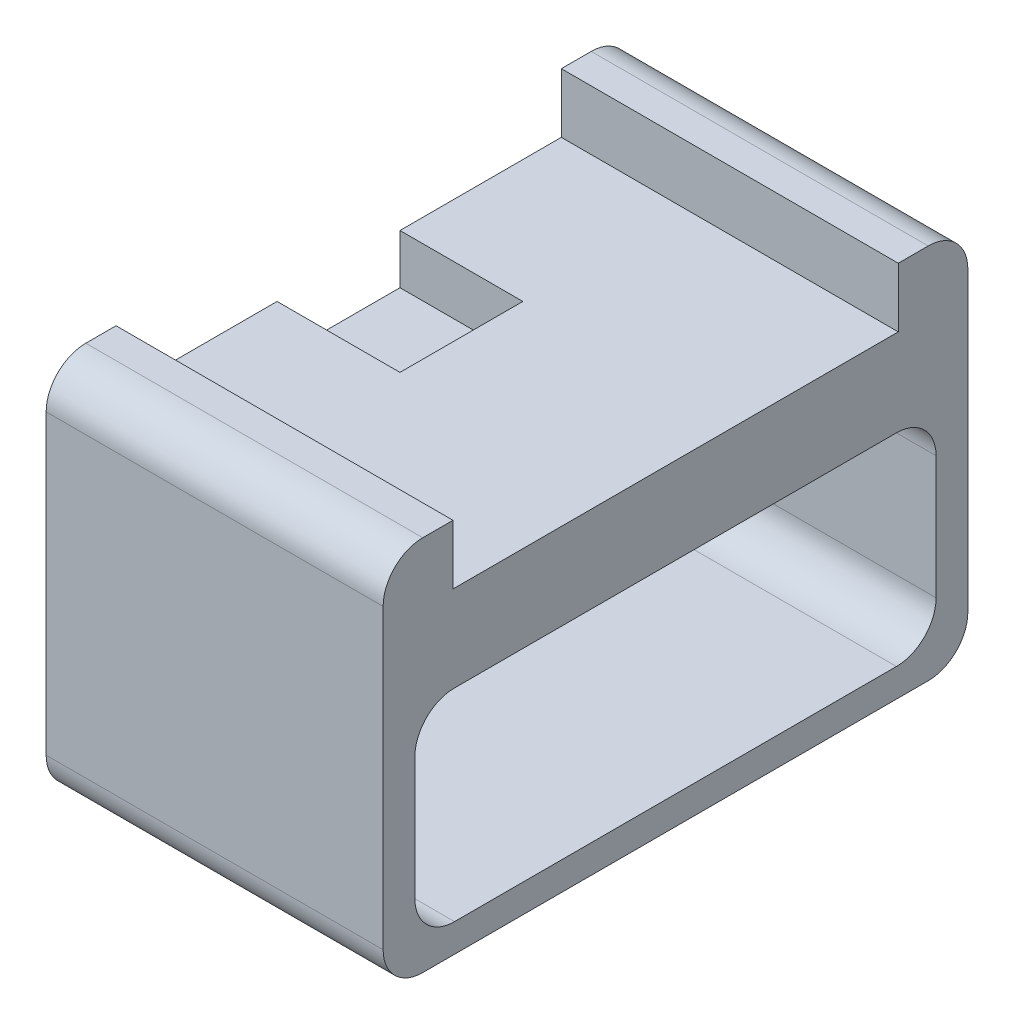
from build123d import *

# Parameters (mm, degrees)
BOSS_EXTRUDE1_DEPTH     = 21
SKETCH5_W               = 6.2
SKETCH5_H               = 6.2
CUT_EXTRUDE1_DEPTH      = 5.5
CUT_EXTRUDE2_DEPTH      = 28.364438602
CUT_EXTRUDE2_DEPTH_BACK = 28.364438602
SKETCH9_W               = 24.284850455
SKETCH9_H               = 22.464844075
CUT_EXTRUDE3_DEPTH      = 3
SKETCH10_W              = 31.815901763
SKETCH10_H              = 21.67332365
CUT_EXTRUDE4_DEPTH      = 4


with BuildPart() as part:
    # Sketch3 → Boss-Extrude1 (new body)
    with BuildSketch(Plane(origin=(0, 0, 0), x_dir=(0, 0, -1), z_dir=(1, 0, 0))):
        with BuildLine():
            Line((-12.75, -9.5), (12.75, -9.5))
            ThreePointArc((12.75, -9.5), (14.164213562, -8.914213562), (14.75, -7.5))
            Line((14.75, -7.5), (14.75, 7.5))
            ThreePointArc((14.75, 7.5), (14.164213562, 8.914213562), (12.75, 9.5))
            Line((12.75, 9.5), (-12.75, 9.5))
            ThreePointArc((-12.75, 9.5), (-14.164213562, 8.914213562), (-14.75, 7.5))
            Line((-14.75, 7.5), (-14.75, -7.5))
            ThreePointArc((-14.75, -7.5), (-14.164213562, -8.914213562), (-12.75, -9.5))
        make_face()
    extrude(amount=BOSS_EXTRUDE1_DEPTH)

    # Sketch5 → Cut-Extrude1 (cut)
    with BuildSketch(Plane(origin=(0, 9.5, 0), x_dir=(1, 0, 0), z_dir=(0, 1, 0))):
        with Locations((3.1, 0)):
            Rectangle(SKETCH5_W, SKETCH5_H)
    extrude(amount=-CUT_EXTRUDE1_DEPTH, mode=Mode.SUBTRACT)

    # Sketch7 → Cut-Extrude2 (cut, two sides: drawn at the far end of the back side and taken through both)
    with BuildSketch(Plane.ZY.offset(-CUT_EXTRUDE2_DEPTH_BACK)):
        with BuildLine():
            Line((-11.147623693, -8.072928754), (11.147623693, -8.072928754))
            ThreePointArc((11.147623693, -8.072928754), (12.561837255, -7.487142316), (13.147623693, -6.072928754))
            Line((13.147623693, -6.072928754), (13.147623693, 0.135263404))
            ThreePointArc((13.147623693, 0.135263404), (12.561837255, 1.549476966), (11.147623693, 2.135263404))
            Line((11.147623693, 2.135263404), (-11.147623693, 2.135263404))
            ThreePointArc((-11.147623693, 2.135263404), (-12.561837255, 1.549476966), (-13.147623693, 0.135263404))
            Line((-13.147623693, 0.135263404), (-13.147623693, -6.072928754))
            ThreePointArc((-13.147623693, -6.072928754), (-12.561837255, -7.487142316), (-11.147623693, -8.072928754))
        make_face()
    extrude(amount=CUT_EXTRUDE2_DEPTH + CUT_EXTRUDE2_DEPTH_BACK, mode=Mode.SUBTRACT)

    # Sketch9 → Cut-Extrude3 (cut)
    with BuildSketch(Plane(origin=(0, 9.5, 0), x_dir=(1, 0, 0), z_dir=(0, 1, 0))):
        with Locations((12.142425228, 0.007615305)):
            Rectangle(SKETCH9_W, SKETCH9_H)
    extrude(amount=-CUT_EXTRUDE3_DEPTH, mode=Mode.SUBTRACT)

    # Sketch10 → Cut-Extrude4 (cut)
    with BuildSketch(Plane(origin=(21, 0, 0), x_dir=(0, 0, -1), z_dir=(1, 0, 0))):
        with Locations((-0.011194899, 0.447795943)):
            Rectangle(SKETCH10_W, SKETCH10_H)
    extrude(amount=-CUT_EXTRUDE4_DEPTH, mode=Mode.SUBTRACT)


solid = part.part
